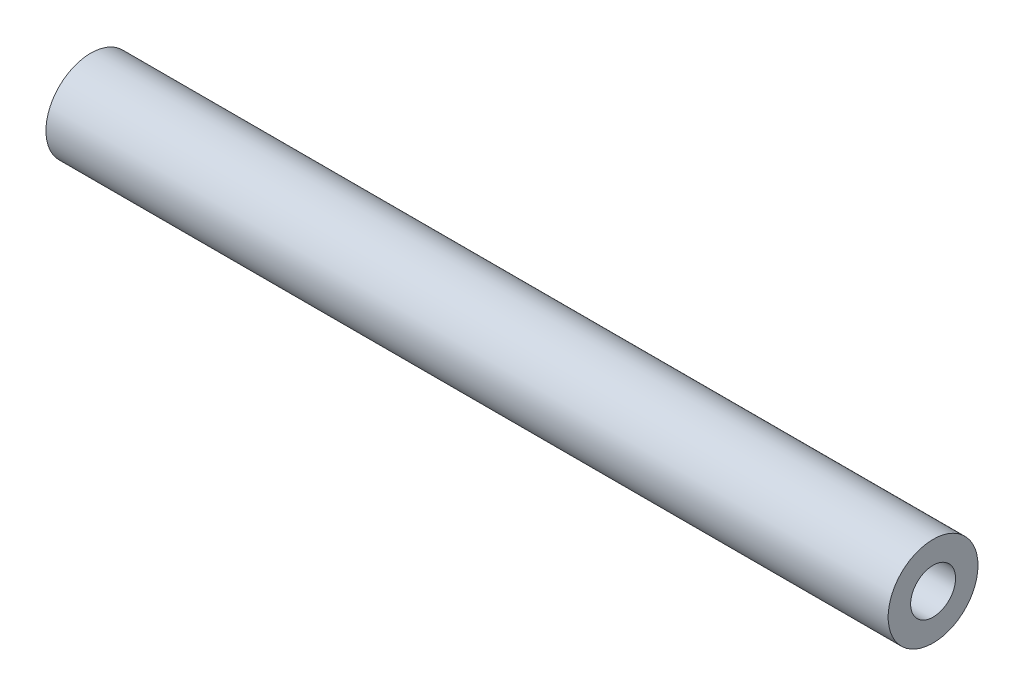
from build123d import *

# Parameters (mm, degrees)
SKETCH1_R           = 4
BOSS_EXTRUDE1_DEPTH = 37.5
SKETCH2_R           = 2
CUT_EXTRUDE1_DEPTH  = 15
CUT_EXTRUDE2_START  = -15
SKETCH3_R           = 2
CUT_EXTRUDE2_DEPTH  = 15


with BuildPart() as part:
    # Sketch1 → Boss-Extrude1 (new, symmetric)
    with BuildSketch(Plane(origin=(0, 0, 0), x_dir=(0, 0, -1), z_dir=(1, 0, 0))):
        Circle(SKETCH1_R)
    extrude(amount=BOSS_EXTRUDE1_DEPTH, both=True)

    # Sketch2 → Cut-Extrude1 (cut)
    with BuildSketch(Plane(origin=(37.5, 0, 0), x_dir=(0, 0, -1), z_dir=(1, 0, 0))):
        Circle(SKETCH2_R)
    extrude(amount=-CUT_EXTRUDE1_DEPTH, mode=Mode.SUBTRACT)

    # Sketch3 → Cut-Extrude2 (cut)
    with BuildSketch(Plane.ZY.offset(37.5).offset(CUT_EXTRUDE2_START)):
        with Locations(Location((0, 0, 0), (0, 0, 180))):
            Circle(SKETCH3_R)
    extrude(amount=CUT_EXTRUDE2_DEPTH, mode=Mode.SUBTRACT)


solid = part.part
